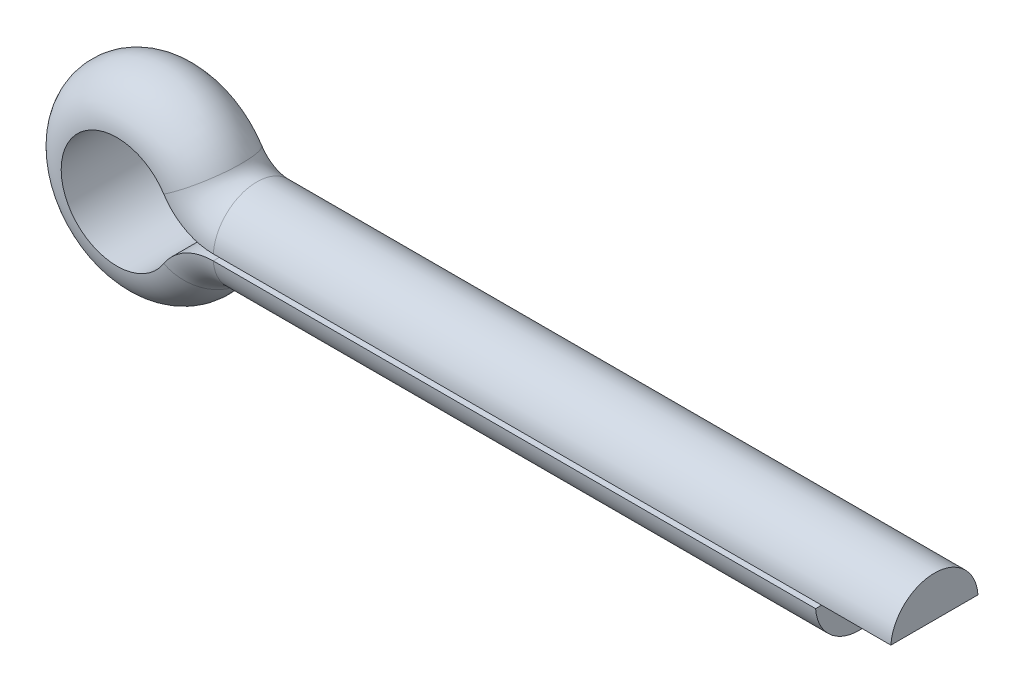
from build123d import *


with BuildPart() as part:
    # По траектории1: sweep along a path in Эскиз2
    with BuildLine(Plane.XY) as sweep_1_path:
        Line((0, 1.45), (-22.5, 1.45))
        ThreePointArc((-22.5, 1.45), (-22.788230128, 1.523664908), (-23.005769592, 1.726592746))
        ThreePointArc((-23.005769592, 1.726592746), (-28.9, 0), (-23.005769592, -1.726592746))
        ThreePointArc((-23.005769592, -1.726592746), (-22.788230128, -1.523664908), (-22.5, -1.45))
        Line((-22.5, -1.45), (-2.5, -1.45))
    # Эскиз1 → По траектории1 (sweep)
    with BuildSketch(Plane(origin=(0, 0, 0), x_dir=(0, 0, -1), z_dir=(1, 0, 0))):
        with BuildLine():
            Line((-1.446547614, 0.1), (1.446547614, 0.1))
            ThreePointArc((1.446547614, 0.1), (0, 1.45), (-1.446547614, 0.1))
        make_face()
    sweep(path=sweep_1_path.line)


solid = part.part
